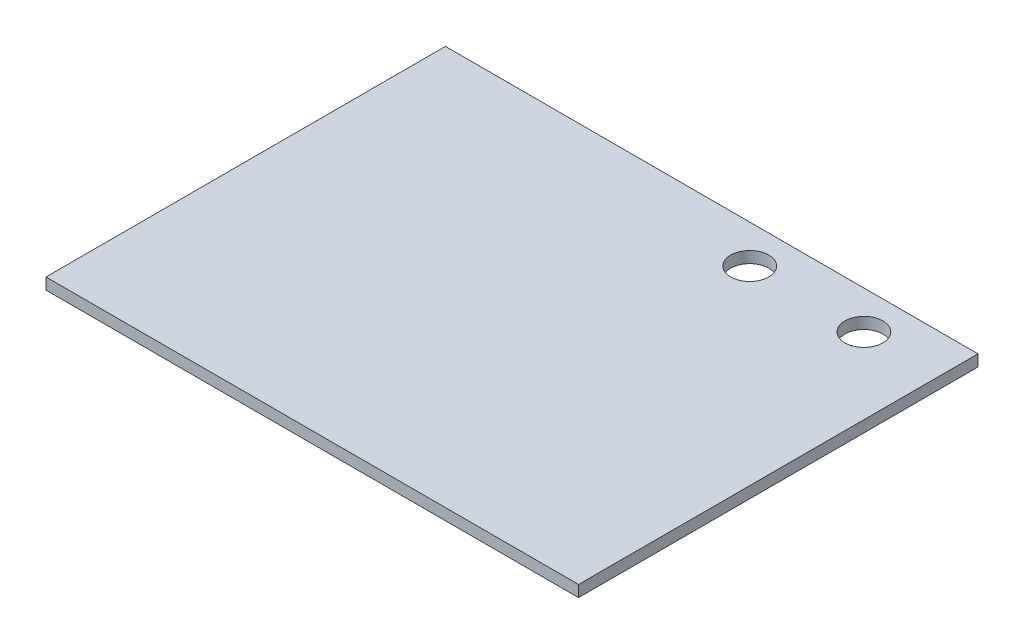
from build123d import *

# Parameters (mm, degrees)
SKETCH1_W           = 140
SKETCH1_H           = 105
BOSS_EXTRUDE1_DEPTH = 3
SKETCH2_R           = 5
CUT_EXTRUDE1_DEPTH  = 10


with BuildPart() as part:
    # Sketch1 → Boss-Extrude1 (new body)
    with BuildSketch(Plane(origin=(0, 0, 0), x_dir=(1, 0, 0), z_dir=(0, 1, 0))):
        Rectangle(SKETCH1_W, SKETCH1_H)
    extrude(amount=BOSS_EXTRUDE1_DEPTH)

    # Sketch2 → Cut-Extrude1 (cut)
    with BuildSketch(Plane(origin=(0, 3, 0), x_dir=(1, 0, 0), z_dir=(0, 1, 0))):
        with Locations(Location((50, 42.5, 0), (0, 0, 270))):
            Circle(SKETCH2_R)
        with Locations(Location((20, 42.5, 0), (0, 0, 270))):
            Circle(SKETCH2_R)
    extrude(amount=-CUT_EXTRUDE1_DEPTH, mode=Mode.SUBTRACT)


solid = part.part
